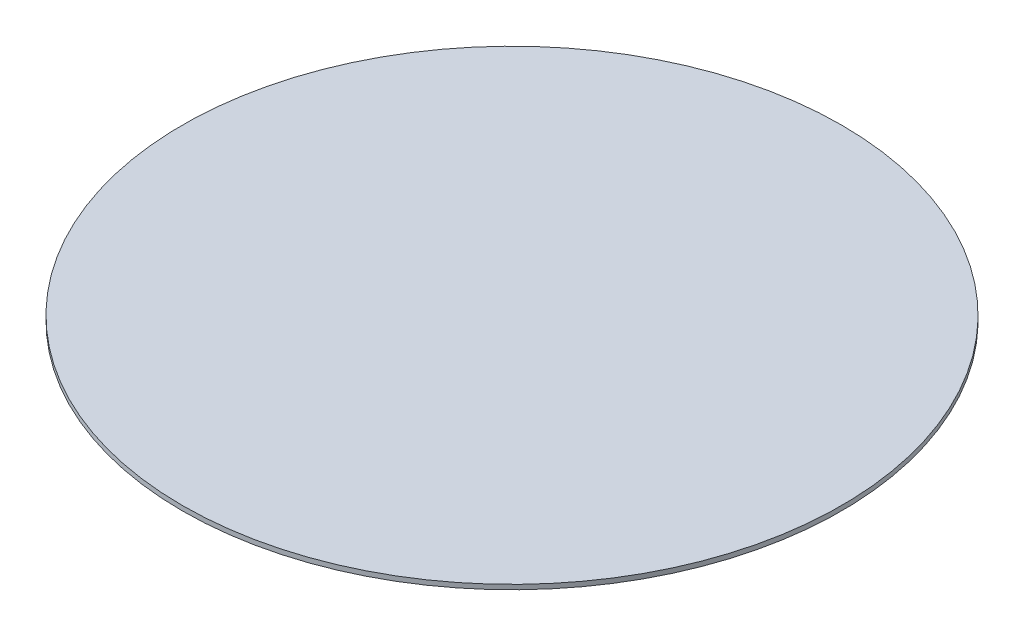
from build123d import *

# Parameters (mm, degrees)
IZIM1_R                     = 350
Y_KSEKLIK_EKSTR_ZYON1_DEPTH = 5


with BuildPart() as part:
    # Çizim1 → Yükseklik-Ekstrüzyon1 (new body)
    with BuildSketch(Plane(origin=(0, 0, 0), x_dir=(1, 0, 0), z_dir=(0, 1, 0))):
        with Locations(Location((0, 0, 0), (0, 0, 270))):
            Circle(IZIM1_R)
    extrude(amount=Y_KSEKLIK_EKSTR_ZYON1_DEPTH)


solid = part.part
